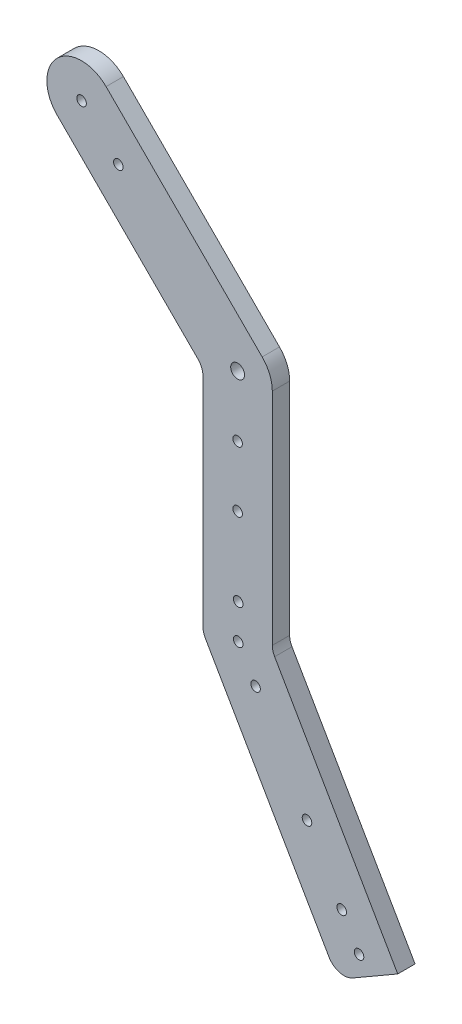
from build123d import *

# Parameters (mm, degrees)
BOSS_EXTRUDE1_DEPTH     = 10
FILLET1_R               = 10
BOSS_EXTRUDE2_DEPTH     = 10
SKETCH3_R               = 2.75
CUT_EXTRUDE1_DEPTH      = 295.996739323
CUT_EXTRUDE2_DEPTH      = 295.996739323
CUT_EXTRUDE2_DEPTH_BACK = 295.996739323
SKETCH5_R               = 2.75
BOSS_EXTRUDE3_DEPTH     = 10
FILLET2_R               = 10
CUT_EXTRUDE3_DEPTH      = 10
SKETCH9_R               = 2.75
CUT_EXTRUDE4_DEPTH      = 387.134691526
SKETCH10_R              = 2.75
CUT_EXTRUDE5_DEPTH      = 387.134691526
CUT_EXTRUDE6_DEPTH      = 387.134691526
CUT_EXTRUDE6_DEPTH_BACK = 387.134691526
SKETCH11_R              = 2.75


with BuildPart() as part:
    # Sketch1 → Boss-Extrude1 (new body)
    with BuildSketch(Plane.XY):
        Polygon((75, -4.903810568), (0, 125), (0, 250), (-20, 250), (-20, 119.641016151), (57.679491924, -14.903810568), align=None)
        Polygon((0, 250), (0, 125), (75, -4.903810568), (92.320508076, 5.096189432), (20, 130.358983849), (20, 250), align=None)
    extrude(amount=BOSS_EXTRUDE1_DEPTH)

    # Fillet1
    fillet1_edges = [part.edges().sort_by_distance(p)[0] for p in [
        (57.679491924, -14.903810568, 5),
        (-20, 119.641016151, 5),
        (20, 130.358983849, 5),
    ]]
    fillet(fillet1_edges, radius=FILLET1_R)

    # Sketch2 → Boss-Extrude2 (add)
    with BuildSketch(Plane.XY.offset(10)):
        with BuildLine():
            Line((0, 250), (20, 250))
            Line((20, 250), (20, 260))
            ThreePointArc((20, 260), (0, 280), (-20, 260))
            Line((-20, 260), (-20, 250))
            Line((-20, 250), (0, 250))
        make_face()
        with BuildLine():
            ThreePointArc((0, 264), (4, 260), (0, 256))
            ThreePointArc((0, 256), (-4, 260), (0, 264))
        make_face(mode=Mode.SUBTRACT)
    extrude(amount=-BOSS_EXTRUDE2_DEPTH)

    # Sketch3 → Cut-Extrude1 (cut, through all)
    with BuildSketch(Plane.XY.offset(10)):
        with Locations((0, 190)):
            Circle(SKETCH3_R)
        with Locations((0, 225)):
            Circle(SKETCH3_R)
    extrude(amount=-CUT_EXTRUDE1_DEPTH, mode=Mode.SUBTRACT)

    # Sketch5 → Cut-Extrude2 (cut, two sides: drawn at the far end of the back side and taken through both)
    with BuildSketch(Plane.XY.offset(10).offset(-CUT_EXTRUDE2_DEPTH_BACK)):
        with Locations((60, 21.076951546)):
            Circle(SKETCH5_R)
        with Locations((70, 3.75644347)):
            Circle(SKETCH5_R)
    extrude(amount=CUT_EXTRUDE2_DEPTH + CUT_EXTRUDE2_DEPTH_BACK, mode=Mode.SUBTRACT)

    # Sketch7 → Boss-Extrude3 (add)
    with BuildSketch(Plane.XY.offset(10)):
        with BuildLine():
            ThreePointArc((-14.142135624, 245.857864376), (-14.142135624, 274.142135624), (14.142135624, 274.142135624))
            Line((14.142135624, 274.142135624), (-105.857864376, 394.142135624))
            ThreePointArc((-105.857864376, 394.142135624), (-134.142135624, 394.142135624), (-134.142135624, 365.857864376))
            Line((-134.142135624, 365.857864376), (-14.142135624, 245.857864376))
        make_face()
    extrude(amount=-BOSS_EXTRUDE3_DEPTH)

    # Fillet2
    fillet2_edges = [part.edges().sort_by_distance(p)[0] for p in [
        (-20, 251.715728753, 5),
    ]]
    fillet(fillet2_edges, radius=FILLET2_R)

    # Sketch8 → Cut-Extrude3 (cut)
    with BuildSketch(Plane.XY.offset(10)):
        with BuildLine():
            ThreePointArc((-104.142135624, 335.857864376), (-104.142135624, 364.142135624), (-75.857864376, 364.142135624))
            Line((-75.857864376, 364.142135624), (-105.857864376, 394.142135624))
            ThreePointArc((-105.857864376, 394.142135624), (-134.142135624, 394.142135624), (-134.142135624, 365.857864376))
            Line((-134.142135624, 365.857864376), (-104.142135624, 335.857864376))
        make_face()
    extrude(amount=-CUT_EXTRUDE3_DEPTH, mode=Mode.SUBTRACT)

    # Sketch9 → Cut-Extrude4 (cut, through all)
    with BuildSketch(Plane.XY.offset(10)):
        with Locations((-90, 350)):
            Circle(SKETCH9_R)
        with Locations((-68.786796564, 328.786796564)):
            Circle(SKETCH9_R)
    extrude(amount=-CUT_EXTRUDE4_DEPTH, mode=Mode.SUBTRACT)

    # Sketch10 → Cut-Extrude5 (cut, through all)
    with BuildSketch(Plane.XY.offset(10)):
        with Locations((40, 55.717967697)):
            Circle(SKETCH10_R)
    extrude(amount=-CUT_EXTRUDE5_DEPTH, mode=Mode.SUBTRACT)

    # Sketch11 → Cut-Extrude6 (cut, two sides: drawn at the far end of the back side and taken through both)
    with BuildSketch(Plane.XY.offset(10).offset(-CUT_EXTRUDE6_DEPTH_BACK)):
        with Locations((0.340741737, 145.091301473)):
            Circle(SKETCH11_R)
        with Locations((0.340741737, 125.091301473)):
            Circle(SKETCH11_R)
        with Locations((10.340741737, 107.770793398)):
            Circle(SKETCH11_R)
    extrude(amount=CUT_EXTRUDE6_DEPTH + CUT_EXTRUDE6_DEPTH_BACK, mode=Mode.SUBTRACT)


solid = part.part
